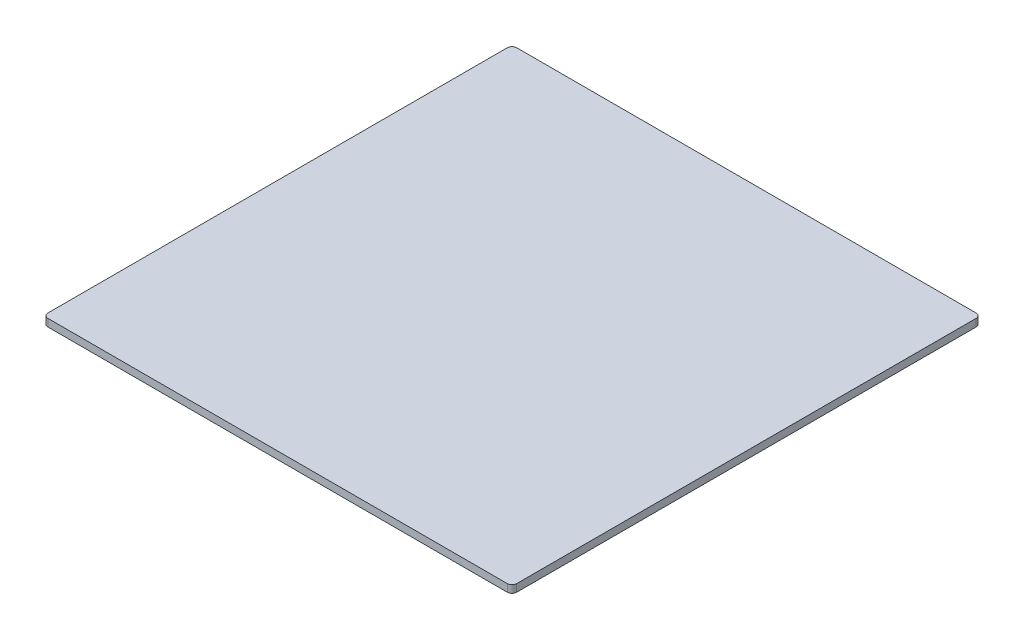
from build123d import *

# Parameters (mm, degrees)
SKETCH1_W           = 100
SKETCH1_H           = 100
BOSS_EXTRUDE1_DEPTH = 0.8
FILLET1_R           = 1


with BuildPart() as part:
    # Sketch1 → Boss-Extrude1 (new, symmetric)
    with BuildSketch(Plane(origin=(0, 0, 0), x_dir=(1, 0, 0), z_dir=(0, 1, 0))):
        Rectangle(SKETCH1_W, SKETCH1_H)
    extrude(amount=BOSS_EXTRUDE1_DEPTH, both=True)

    # Fillet1
    fillet1_edges = [part.edges().sort_by_distance(p)[0] for p in [
        (50, 0, 50),
        (-50, 0, 50),
        (-50, 0, -50),
        (50, 0, -50),
    ]]
    fillet(fillet1_edges, radius=FILLET1_R)


solid = part.part
